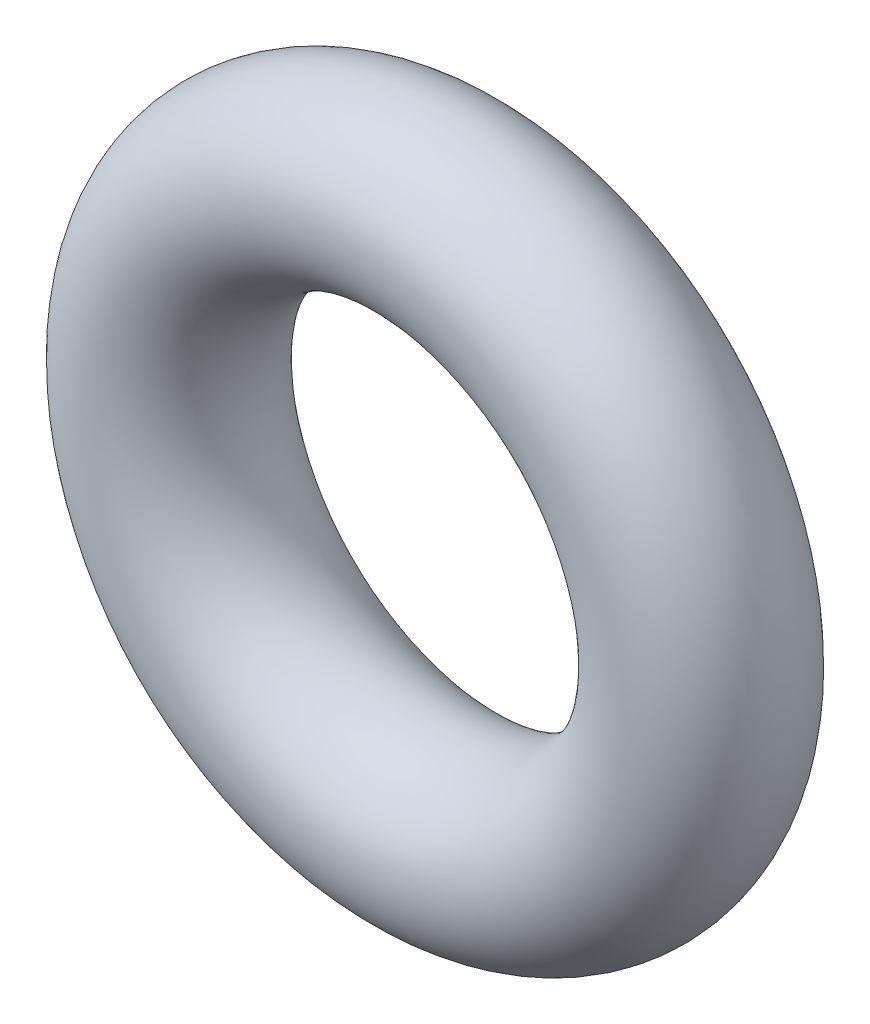
from build123d import *

# Parameters (mm, degrees)
SKETCH1_R = 0.889


with BuildPart() as part:
    # Sketch1 → Revolve1 (revolve)
    with BuildSketch(Plane(origin=(0, 0, 0), x_dir=(0, -1, 0), z_dir=(1, 0, 0)), mode=Mode.PRIVATE) as revolve1_sk:
        with Locations((2.7305, 0)):
            Circle(SKETCH1_R)
    revolve(revolve1_sk.sketch.rotate(Axis((0, 0, 0.889), (0, 0, -1)), 270), axis=Axis((0, 0, 0.889), (0, 0, -1)))


solid = part.part
